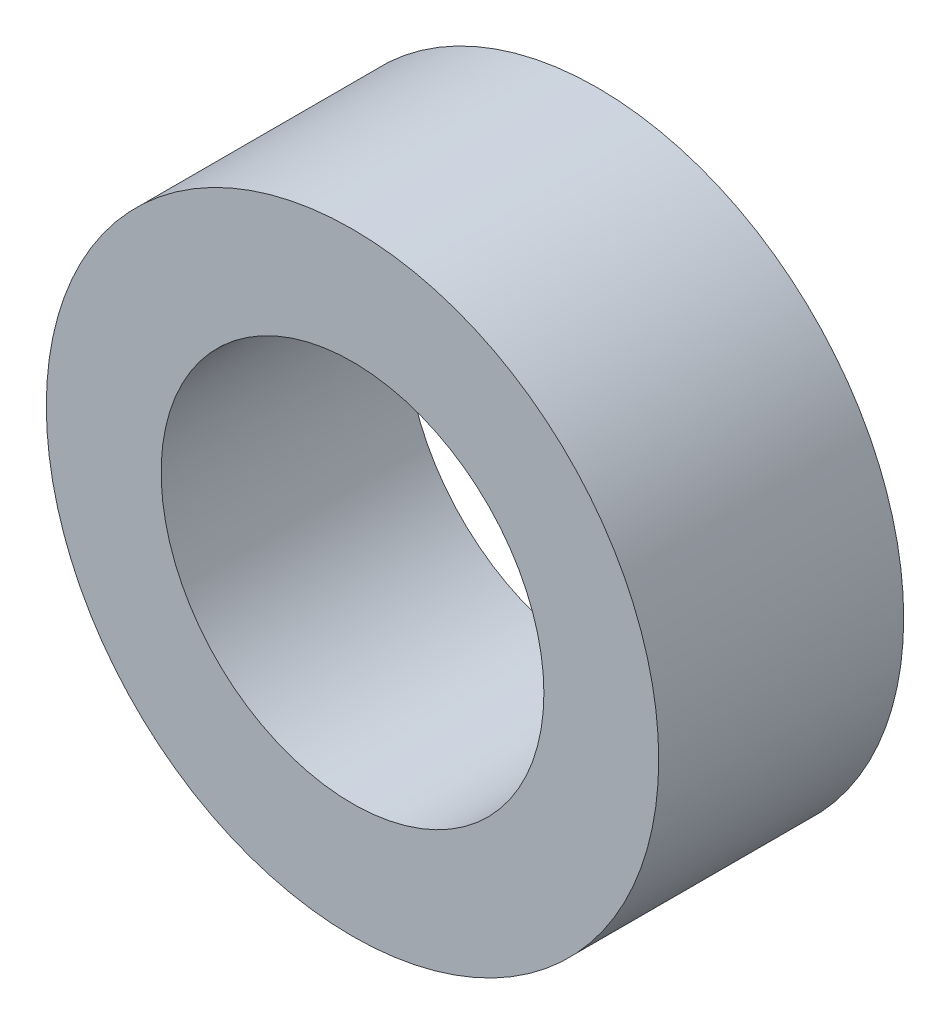
from build123d import *

# Parameters (mm, degrees)
SKETCH_1_R      = 4
SKETCH_1_R_2    = 2.5
EXTRUDE_1_DEPTH = 3.2


with BuildPart() as part:
    # 草图1 → 凸台-拉伸1 (new body)
    with BuildSketch(Plane.XY):
        Circle(SKETCH_1_R)
        Circle(SKETCH_1_R_2, mode=Mode.SUBTRACT)
    extrude(amount=EXTRUDE_1_DEPTH)


solid = part.part
